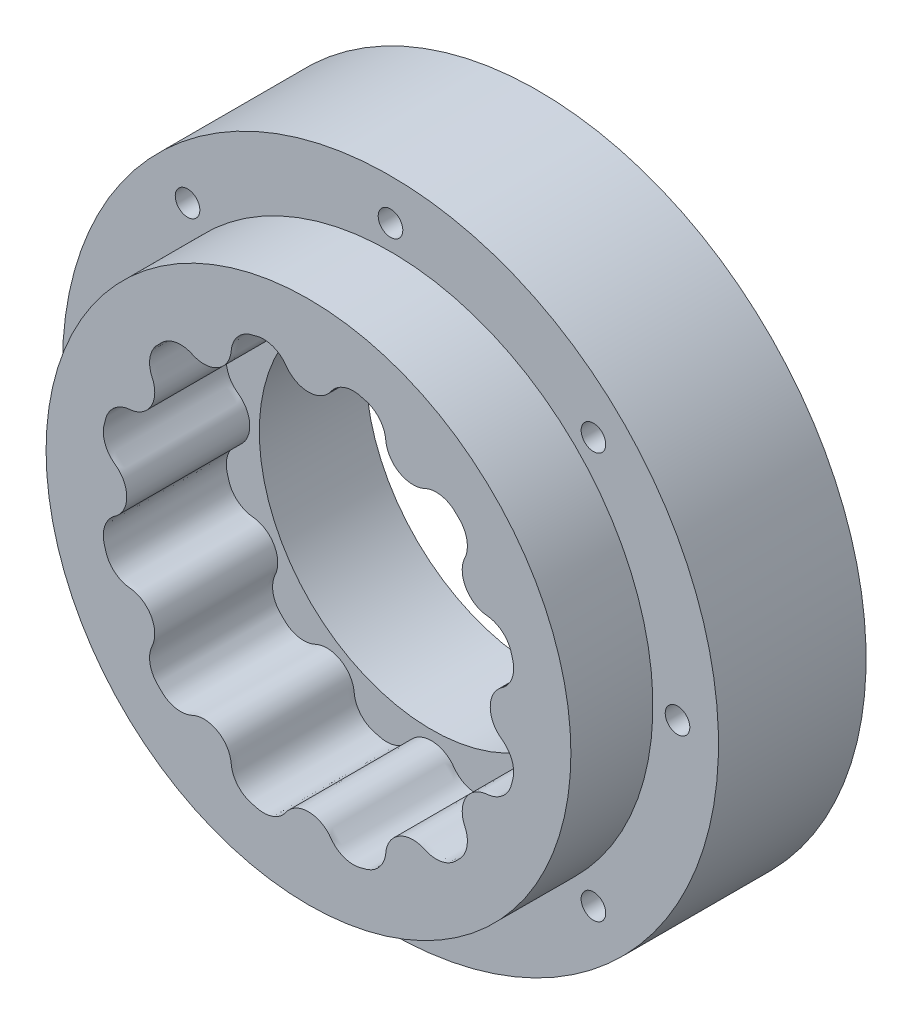
from build123d import *

# Parameters (mm, degrees)
SKETCH1_R           = 32
BOSS_EXTRUDE1_DEPTH = 15
SKETCH3_R           = 40
SKETCH3_R_2         = 30
BOSS_EXTRUDE3_DEPTH = 5
BOSS_EXTRUDE4_START = 13
SKETCH4_R           = 40
SKETCH4_R_2         = 21
BOSS_EXTRUDE4_DEPTH = 13
SKETCH5_R           = 1.5
CUT_EXTRUDE1_DEPTH  = 20
SKETCH6_R           = 2.5
CUT_EXTRUDE2_DEPTH  = 3


with BuildPart() as part:
    # Sketch1 → Boss-Extrude1 (new body)
    with BuildSketch(Plane.XY):
        Circle(SKETCH1_R)
        with BuildLine():
            add(Edge.make_bspline(
                [(7.008727405, -24.725851657), (8.387650315, -24.334985655), (9.300444766, -23.229992029), (9.423952389, -21.802073792), (9.424010864, -21.801397737), (9.424127402, -21.800045592), (9.424300875, -21.79801726), (9.42441742, -21.796665116), (9.424475899, -21.795989061), (9.64427829, -19.254928914), (11.853118443, -17.979654457), (14.163642278, -19.059830077), (14.164256998, -19.06011746), (14.165486262, -19.060692601), (14.167329586, -19.061556535), (14.168558847, -19.062131682), (14.169173565, -19.062419069), (15.452230516, -19.662259733), (16.850366203, -19.435851779), (17.878544188, -18.46173988), (17.885306871, -18.455332808), (17.898778593, -18.442462044), (17.918818206, -18.422980608), (17.93216718, -18.409982809), (17.938838132, -18.403480282), (18.095694749, -18.250583904), (18.250583904, -18.095694749), (18.403480282, -17.938838132), (18.409982809, -17.93216718), (18.422980608, -17.918818206), (18.442462044, -17.898778593), (18.455332808, -17.885306871), (18.46173988, -17.878544188), (19.435851779, -16.850366203), (19.662259733, -15.452230516), (19.062419069, -14.169173565), (19.062131682, -14.168558847), (19.061556535, -14.167329586), (19.060692601, -14.165486262), (19.06011746, -14.164256998), (19.059830077, -14.163642278), (17.979654457, -11.853118443), (19.254928914, -9.64427829), (21.795989061, -9.424475899), (21.796665116, -9.42441742), (21.79801726, -9.424300875), (21.800045592, -9.424127402), (21.801397737, -9.424010864), (21.802073792, -9.423952389), (23.213154038, -9.301901166), (24.310771085, -8.406758284), (24.71414339, -7.04906364), (24.716796509, -7.040133612), (24.72202798, -7.022251341), (24.729642076, -6.995360117), (24.734703727, -6.977429206), (24.737229677, -6.968462376), (24.796623304, -6.75762192), (24.85331667, -6.5460394), (24.907300508, -6.333749395), (24.909596386, -6.324720918), (24.914178322, -6.306661468), (24.921029935, -6.279565937), (24.925440483, -6.261463701), (24.927607828, -6.25240351), (25.257124487, -4.874919305), (24.754131682, -3.550894306), (23.593125953, -2.739654723), (23.59256971, -2.739266055), (23.591456988, -2.738489058), (23.589787137, -2.73732466), (23.588674418, -2.736547656), (23.588118177, -2.736158985), (21.497396733, -1.275274457), (21.497396733, 1.275274457), (23.588118177, 2.736158985), (23.588674418, 2.736547656), (23.589787137, 2.73732466), (23.591456988, 2.738489058), (23.59256971, 2.739266055), (23.593125953, 2.739654723), (24.754131682, 3.550894306), (25.257124487, 4.874919305), (24.927607828, 6.25240351), (24.925440483, 6.261463701), (24.921029935, 6.279565937), (24.914178322, 6.306661468), (24.909596386, 6.324720918), (24.907300508, 6.333749395), (24.85331667, 6.5460394), (24.796623304, 6.75762192), (24.737229677, 6.968462376), (24.734703727, 6.977429206), (24.729642076, 6.995360117), (24.72202798, 7.022251341), (24.716796509, 7.040133612), (24.71414339, 7.04906364), (24.310771085, 8.406758284), (23.213154038, 9.301901166), (21.802073792, 9.423952389), (21.801397737, 9.424010864), (21.800045592, 9.424127402), (21.79801726, 9.424300875), (21.796665116, 9.42441742), (21.795989061, 9.424475899), (19.254928914, 9.64427829), (17.979654457, 11.853118443), (19.059830077, 14.163642278), (19.06011746, 14.164256998), (19.060692601, 14.165486262), (19.061556535, 14.167329586), (19.062131682, 14.168558847), (19.062419069, 14.169173565), (19.662259733, 15.452230516), (19.435851779, 16.850366203), (18.46173988, 17.878544188), (18.455332808, 17.885306871), (18.442462044, 17.898778593), (18.422980608, 17.918818206), (18.409982809, 17.93216718), (18.403480282, 17.938838132), (18.250583904, 18.095694749), (18.095694749, 18.250583904), (17.938838132, 18.403480282), (17.93216718, 18.409982809), (17.918818206, 18.422980608), (17.898778593, 18.442462044), (17.885306871, 18.455332808), (17.878544188, 18.46173988), (16.850366203, 19.435851779), (15.452230516, 19.662259733), (14.169173565, 19.062419069), (14.168558847, 19.062131682), (14.167329586, 19.061556535), (14.165486262, 19.060692601), (14.164256998, 19.06011746), (14.163642278, 19.059830077), (11.853118443, 17.979654457), (9.64427829, 19.254928914), (9.424475899, 21.795989061), (9.42441742, 21.796665116), (9.424300875, 21.79801726), (9.424127402, 21.800045592), (9.424010864, 21.801397737), (9.423952389, 21.802073792), (9.301901166, 23.213154038), (8.406758284, 24.310771085), (7.04906364, 24.71414339), (7.040133612, 24.716796509), (7.022251341, 24.72202798), (6.995360117, 24.729642076), (6.977429206, 24.734703727), (6.968462376, 24.737229677), (6.75762192, 24.796623304), (6.5460394, 24.85331667), (6.333749395, 24.907300508), (6.324720918, 24.909596386), (6.306661468, 24.914178322), (6.279565937, 24.921029935), (6.261463701, 24.925440483), (6.25240351, 24.927607828), (4.874919305, 25.257124487), (3.550894306, 24.754131682), (2.739654723, 23.593125953), (2.739266055, 23.59256971), (2.738489058, 23.591456988), (2.73732466, 23.589787137), (2.736547656, 23.588674418), (2.736158985, 23.588118177), (1.275274457, 21.497396733), (-1.275274457, 21.497396733), (-2.736158985, 23.588118177), (-2.736547656, 23.588674418), (-2.73732466, 23.589787137), (-2.738489058, 23.591456988), (-2.739266055, 23.59256971), (-2.739654723, 23.593125953), (-3.550894306, 24.754131682), (-4.874919305, 25.257124487), (-6.25240351, 24.927607828), (-6.261463701, 24.925440483), (-6.279565937, 24.921029935), (-6.306661468, 24.914178322), (-6.324720918, 24.909596386), (-6.333749395, 24.907300508), (-6.5460394, 24.85331667), (-6.75762192, 24.796623304), (-6.968462376, 24.737229677), (-6.977429206, 24.734703727), (-6.995360117, 24.729642076), (-7.022251341, 24.72202798), (-7.040133612, 24.716796509), (-7.04906364, 24.71414339), (-8.406758284, 24.310771085), (-9.301901166, 23.213154038), (-9.423952389, 21.802073792), (-9.424010864, 21.801397737), (-9.424127402, 21.800045592), (-9.424300875, 21.79801726), (-9.42441742, 21.796665116), (-9.424475899, 21.795989061), (-9.64427829, 19.254928914), (-11.853118443, 17.979654457), (-14.163642278, 19.059830077), (-14.164256998, 19.06011746), (-14.165486262, 19.060692601), (-14.167329586, 19.061556535), (-14.168558847, 19.062131682), (-14.169173565, 19.062419069), (-15.452230516, 19.662259733), (-16.850366203, 19.435851779), (-17.878544188, 18.46173988), (-17.885306871, 18.455332808), (-17.898778593, 18.442462044), (-17.918818206, 18.422980608), (-17.93216718, 18.409982809), (-17.938838132, 18.403480282), (-18.095694749, 18.250583904), (-18.250583904, 18.095694749), (-18.403480282, 17.938838132), (-18.409982809, 17.93216718), (-18.422980608, 17.918818206), (-18.442462044, 17.898778593), (-18.455332808, 17.885306871), (-18.46173988, 17.878544188), (-19.435851779, 16.850366203), (-19.662259733, 15.452230516), (-19.062419069, 14.169173565), (-19.062131682, 14.168558847), (-19.061556535, 14.167329586), (-19.060692601, 14.165486262), (-19.06011746, 14.164256998), (-19.059830077, 14.163642278), (-17.979654457, 11.853118443), (-19.254928914, 9.64427829), (-21.795989061, 9.424475899), (-21.796665116, 9.42441742), (-21.79801726, 9.424300875), (-21.800045592, 9.424127402), (-21.801397737, 9.424010864), (-21.802073792, 9.423952389), (-23.213154038, 9.301901166), (-24.310771085, 8.406758284), (-24.71414339, 7.04906364), (-24.716796509, 7.040133612), (-24.72202798, 7.022251341), (-24.729642076, 6.995360117), (-24.734703727, 6.977429206), (-24.737229677, 6.968462376), (-24.796623304, 6.75762192), (-24.85331667, 6.5460394), (-24.907300508, 6.333749395), (-24.909596386, 6.324720918), (-24.914178322, 6.306661468), (-24.921029935, 6.279565937), (-24.925440483, 6.261463701), (-24.927607828, 6.25240351), (-25.257124487, 4.874919305), (-24.754131682, 3.550894306), (-23.593125953, 2.739654723), (-23.59256971, 2.739266055), (-23.591456988, 2.738489058), (-23.589787137, 2.73732466), (-23.588674418, 2.736547656), (-23.588118177, 2.736158985), (-21.497396733, 1.275274457), (-21.497396733, -1.275274457), (-23.588118177, -2.736158985), (-23.588674418, -2.736547656), (-23.589787137, -2.73732466), (-23.591456988, -2.738489058), (-23.59256971, -2.739266055), (-23.593125953, -2.739654723), (-24.754131682, -3.550894306), (-25.257124487, -4.874919305), (-24.927607828, -6.25240351), (-24.925440483, -6.261463701), (-24.921029935, -6.279565937), (-24.914178322, -6.306661468), (-24.909596386, -6.324720918), (-24.907300508, -6.333749395), (-24.85331667, -6.5460394), (-24.796623304, -6.75762192), (-24.737229677, -6.968462376), (-24.734703727, -6.977429206), (-24.729642076, -6.995360117), (-24.72202798, -7.022251341), (-24.716796509, -7.040133612), (-24.71414339, -7.04906364), (-24.310771085, -8.406758284), (-23.213154038, -9.301901166), (-21.802073792, -9.423952389), (-21.801397737, -9.424010864), (-21.800045592, -9.424127402), (-21.79801726, -9.424300875), (-21.796665116, -9.42441742), (-21.795989061, -9.424475899), (-19.254928914, -9.64427829), (-17.979654457, -11.853118443), (-19.059830077, -14.163642278), (-19.06011746, -14.164256998), (-19.060692601, -14.165486262), (-19.061556535, -14.167329586), (-19.062131682, -14.168558847), (-19.062419069, -14.169173565), (-19.662259733, -15.452230516), (-19.435851779, -16.850366203), (-18.46173988, -17.878544188), (-18.455332808, -17.885306871), (-18.442462044, -17.898778593), (-18.422980608, -17.918818206), (-18.409982809, -17.93216718), (-18.403480282, -17.938838132), (-18.250583904, -18.095694749), (-18.095694749, -18.250583904), (-17.938838132, -18.403480282), (-17.93216718, -18.409982809), (-17.918818206, -18.422980608), (-17.898778593, -18.442462044), (-17.885306871, -18.455332808), (-17.878544188, -18.46173988), (-16.850366203, -19.435851779), (-15.452230516, -19.662259733), (-14.169173565, -19.062419069), (-14.168558847, -19.062131682), (-14.167329586, -19.061556535), (-14.165486262, -19.060692601), (-14.164256998, -19.06011746), (-14.163642278, -19.059830077), (-11.853118443, -17.979654457), (-9.64427829, -19.254928914), (-9.424475899, -21.795989061), (-9.42441742, -21.796665116), (-9.424300875, -21.79801726), (-9.424127402, -21.800045592), (-9.424010864, -21.801397737), (-9.423952389, -21.802073792), (-9.301901166, -23.213154038), (-8.406758284, -24.310771085), (-7.04906364, -24.71414339), (-7.040133612, -24.716796509), (-7.022251341, -24.72202798), (-6.995360117, -24.729642076), (-6.977429206, -24.734703727), (-6.968462376, -24.737229677), (-6.75762192, -24.796623304), (-6.5460394, -24.85331667), (-6.333749395, -24.907300508), (-6.324720918, -24.909596386), (-6.306661468, -24.914178322), (-6.279565937, -24.921029935), (-6.261463701, -24.925440483), (-6.25240351, -24.927607828), (-4.874919305, -25.257124487), (-3.550894306, -24.754131682), (-2.739654723, -23.593125953), (-2.739266055, -23.59256971), (-2.738489058, -23.591456988), (-2.73732466, -23.589787137), (-2.736547656, -23.588674418), (-2.736158985, -23.588118177), (-1.275274457, -21.497396733), (1.275274457, -21.497396733), (2.736158985, -23.588118177), (2.736547656, -23.588674418), (2.73732466, -23.589787137), (2.738489058, -23.591456988), (2.739266055, -23.59256971), (2.739654723, -23.593125953), (3.56057458, -24.76798561), (4.903574577, -25.268540935), (6.293189848, -24.917579368), (6.372992785, -24.897424319), (6.531107676, -24.851210749), (6.769500213, -24.787333662), (6.92953851, -24.748298341), (7.008727405, -24.725851657)],
                knots=[0, 0, 0, 0, 0.022861669, 0.022861669, 0.022861669, 0.022873941, 0.022886214, 0.022898486, 0.022898486, 0.022898486, 0.055887763, 0.055887763, 0.055887763, 0.055900036, 0.055912308, 0.05592458, 0.05592458, 0.05592458, 0.078577418, 0.078577418, 0.078577418, 0.078745896, 0.078914374, 0.079082852, 0.079082852, 0.079082852, 0.083044128, 0.083044128, 0.083044128, 0.083212606, 0.083381085, 0.083549563, 0.083549563, 0.083549563, 0.1062024, 0.1062024, 0.1062024, 0.106214673, 0.106226945, 0.106239217, 0.106239217, 0.106239217, 0.139228495, 0.139228495, 0.139228495, 0.139240767, 0.139253039, 0.139265311, 0.139265311, 0.139265311, 0.161918149, 0.161918149, 0.161918149, 0.162086627, 0.162255106, 0.162423584, 0.162423584, 0.162423584, 0.16638486, 0.16638486, 0.16638486, 0.166553338, 0.166721816, 0.166890294, 0.166890294, 0.166890294, 0.189543132, 0.189543132, 0.189543132, 0.189555404, 0.189567676, 0.189579948, 0.189579948, 0.189579948, 0.222569226, 0.222569226, 0.222569226, 0.222581498, 0.222593771, 0.222606043, 0.222606043, 0.222606043, 0.24525888, 0.24525888, 0.24525888, 0.245427359, 0.245595837, 0.245764315, 0.245764315, 0.245764315, 0.249725591, 0.249725591, 0.249725591, 0.249894069, 0.250062547, 0.250231025, 0.250231025, 0.250231025, 0.272883863, 0.272883863, 0.272883863, 0.272896135, 0.272908408, 0.27292068, 0.27292068, 0.27292068, 0.305909957, 0.305909957, 0.305909957, 0.30592223, 0.305934502, 0.305946774, 0.305946774, 0.305946774, 0.328599612, 0.328599612, 0.328599612, 0.32876809, 0.328936568, 0.329105046, 0.329105046, 0.329105046, 0.333066322, 0.333066322, 0.333066322, 0.3332348, 0.333403279, 0.333571757, 0.333571757, 0.333571757, 0.356224594, 0.356224594, 0.356224594, 0.356236867, 0.356249139, 0.356261411, 0.356261411, 0.356261411, 0.389250689, 0.389250689, 0.389250689, 0.389262961, 0.389275233, 0.389287505, 0.389287505, 0.389287505, 0.411940343, 0.411940343, 0.411940343, 0.412108821, 0.4122773, 0.412445778, 0.412445778, 0.412445778, 0.416407054, 0.416407054, 0.416407054, 0.416575532, 0.41674401, 0.416912488, 0.416912488, 0.416912488, 0.439565326, 0.439565326, 0.439565326, 0.439577598, 0.43958987, 0.439602142, 0.439602142, 0.439602142, 0.47259142, 0.47259142, 0.47259142, 0.472603692, 0.472615965, 0.472628237, 0.472628237, 0.472628237, 0.495281074, 0.495281074, 0.495281074, 0.495449553, 0.495618031, 0.495786509, 0.495786509, 0.495786509, 0.499747785, 0.499747785, 0.499747785, 0.499916263, 0.500084741, 0.500253219, 0.500253219, 0.500253219, 0.522906057, 0.522906057, 0.522906057, 0.522918329, 0.522930602, 0.522942874, 0.522942874, 0.522942874, 0.555932151, 0.555932151, 0.555932151, 0.555944424, 0.555956696, 0.555968968, 0.555968968, 0.555968968, 0.578621806, 0.578621806, 0.578621806, 0.578790284, 0.578958762, 0.57912724, 0.57912724, 0.57912724, 0.583088516, 0.583088516, 0.583088516, 0.583256994, 0.583425473, 0.583593951, 0.583593951, 0.583593951, 0.606246788, 0.606246788, 0.606246788, 0.606259061, 0.606271333, 0.606283605, 0.606283605, 0.606283605, 0.639272883, 0.639272883, 0.639272883, 0.639285155, 0.639297427, 0.639309699, 0.639309699, 0.639309699, 0.661962537, 0.661962537, 0.661962537, 0.662131015, 0.662299493, 0.662467972, 0.662467972, 0.662467972, 0.666429248, 0.666429248, 0.666429248, 0.666597726, 0.666766204, 0.666934682, 0.666934682, 0.666934682, 0.68958752, 0.68958752, 0.68958752, 0.689599792, 0.689612064, 0.689624336, 0.689624336, 0.689624336, 0.722613614, 0.722613614, 0.722613614, 0.722625886, 0.722638159, 0.722650431, 0.722650431, 0.722650431, 0.745303268, 0.745303268, 0.745303268, 0.745471747, 0.745640225, 0.745808703, 0.745808703, 0.745808703, 0.749769979, 0.749769979, 0.749769979, 0.749938457, 0.750106935, 0.750275413, 0.750275413, 0.750275413, 0.772928251, 0.772928251, 0.772928251, 0.772940523, 0.772952796, 0.772965068, 0.772965068, 0.772965068, 0.805954345, 0.805954345, 0.805954345, 0.805966618, 0.80597889, 0.805991162, 0.805991162, 0.805991162, 0.828644, 0.828644, 0.828644, 0.828812478, 0.828980956, 0.829149434, 0.829149434, 0.829149434, 0.83311071, 0.83311071, 0.83311071, 0.833279188, 0.833447667, 0.833616145, 0.833616145, 0.833616145, 0.856268982, 0.856268982, 0.856268982, 0.856281255, 0.856293527, 0.856305799, 0.856305799, 0.856305799, 0.889295077, 0.889295077, 0.889295077, 0.889307349, 0.889319621, 0.889331893, 0.889331893, 0.889331893, 0.911984731, 0.911984731, 0.911984731, 0.912153209, 0.912321687, 0.912490166, 0.912490166, 0.912490166, 0.916451442, 0.916451442, 0.916451442, 0.91661992, 0.916788398, 0.916956876, 0.916956876, 0.916956876, 0.939609714, 0.939609714, 0.939609714, 0.939621986, 0.939634258, 0.93964653, 0.93964653, 0.93964653, 0.972635808, 0.972635808, 0.972635808, 0.97264808, 0.972660353, 0.972672625, 0.972672625, 0.972672625, 0.995534294, 0.995534294, 0.995534294, 0.997022863, 0.998511431, 1, 1, 1, 1], degree=3, weights=[1, 0.881989361, 0.881989361, 1, 1, 1, 1, 1, 1, 0.715181732, 0.715181732, 1, 1, 1, 1, 1, 1, 0.884361143, 0.884361143, 1, 1, 1, 1, 1, 1, 0.99994552, 0.99994552, 1, 1, 1, 1, 1, 1, 0.884361143, 0.884361143, 1, 1, 1, 1, 1, 1, 0.715181732, 0.715181732, 1, 1, 1, 1, 1, 1, 0.884361143, 0.884361143, 1, 1, 1, 1, 1, 1, 0.99994552, 0.99994552, 1, 1, 1, 1, 1, 1, 0.884361143, 0.884361143, 1, 1, 1, 1, 1, 1, 0.715181732, 0.715181732, 1, 1, 1, 1, 1, 1, 0.884361143, 0.884361143, 1, 1, 1, 1, 1, 1, 0.99994552, 0.99994552, 1, 1, 1, 1, 1, 1, 0.884361143, 0.884361143, 1, 1, 1, 1, 1, 1, 0.715181732, 0.715181732, 1, 1, 1, 1, 1, 1, 0.884361143, 0.884361143, 1, 1, 1, 1, 1, 1, 0.99994552, 0.99994552, 1, 1, 1, 1, 1, 1, 0.884361143, 0.884361143, 1, 1, 1, 1, 1, 1, 0.715181732, 0.715181732, 1, 1, 1, 1, 1, 1, 0.884361143, 0.884361143, 1, 1, 1, 1, 1, 1, 0.99994552, 0.99994552, 1, 1, 1, 1, 1, 1, 0.884361143, 0.884361143, 1, 1, 1, 1, 1, 1, 0.715181732, 0.715181732, 1, 1, 1, 1, 1, 1, 0.884361143, 0.884361143, 1, 1, 1, 1, 1, 1, 0.99994552, 0.99994552, 1, 1, 1, 1, 1, 1, 0.884361143, 0.884361143, 1, 1, 1, 1, 1, 1, 0.715181732, 0.715181732, 1, 1, 1, 1, 1, 1, 0.884361143, 0.884361143, 1, 1, 1, 1, 1, 1, 0.99994552, 0.99994552, 1, 1, 1, 1, 1, 1, 0.884361143, 0.884361143, 1, 1, 1, 1, 1, 1, 0.715181732, 0.715181732, 1, 1, 1, 1, 1, 1, 0.884361143, 0.884361143, 1, 1, 1, 1, 1, 1, 0.99994552, 0.99994552, 1, 1, 1, 1, 1, 1, 0.884361143, 0.884361143, 1, 1, 1, 1, 1, 1, 0.715181732, 0.715181732, 1, 1, 1, 1, 1, 1, 0.884361143, 0.884361143, 1, 1, 1, 1, 1, 1, 0.99994552, 0.99994552, 1, 1, 1, 1, 1, 1, 0.884361143, 0.884361143, 1, 1, 1, 1, 1, 1, 0.715181732, 0.715181732, 1, 1, 1, 1, 1, 1, 0.884361143, 0.884361143, 1, 1, 1, 1, 1, 1, 0.99994552, 0.99994552, 1, 1, 1, 1, 1, 1, 0.884361143, 0.884361143, 1, 1, 1, 1, 1, 1, 0.715181732, 0.715181732, 1, 1, 1, 1, 1, 1, 0.884361143, 0.884361143, 1, 1, 1, 1, 1, 1, 0.99994552, 0.99994552, 1, 1, 1, 1, 1, 1, 0.884361143, 0.884361143, 1, 1, 1, 1, 1, 1, 0.715181732, 0.715181732, 1, 1, 1, 1, 1, 1, 0.881989361, 0.881989361, 1, 1, 1, 1, 1, 1]))
        make_face(mode=Mode.SUBTRACT)
    extrude(amount=BOSS_EXTRUDE1_DEPTH)

    # Sketch3 → Boss-Extrude3 (add)
    with BuildSketch(Plane(origin=(0, 0, 0), x_dir=(-1, 0, 0), z_dir=(0, 0, -1))):
        Circle(SKETCH3_R)
        Circle(SKETCH3_R_2, mode=Mode.SUBTRACT)
    extrude(amount=-BOSS_EXTRUDE3_DEPTH)

    # Sketch4 → Boss-Extrude4 (add)
    with BuildSketch(Plane(origin=(0, 0, 0), x_dir=(-1, 0, 0), z_dir=(0, 0, -1)).offset(BOSS_EXTRUDE4_START)):
        Circle(SKETCH4_R)
        with Locations(Location((0, 0, 0), (0, 0, 180))):
            Circle(SKETCH4_R_2, mode=Mode.SUBTRACT)
    extrude(amount=-BOSS_EXTRUDE4_DEPTH)

    # Sketch5 → Cut-Extrude1 (cut)
    with BuildSketch(Plane(origin=(0, 0, -13), x_dir=(-1, 0, 0), z_dir=(0, 0, -1))):
        with Locations((0, 35)):
            Circle(SKETCH5_R)
        with Locations((24.748737342, 24.748737342)):
            Circle(SKETCH5_R)
        with Locations((35, 0)):
            Circle(SKETCH5_R)
        with Locations((24.748737342, -24.748737342)):
            Circle(SKETCH5_R)
        with Locations((0, -35)):
            Circle(SKETCH5_R)
        with Locations((-24.748737342, -24.748737342)):
            Circle(SKETCH5_R)
        with Locations((-35, 0)):
            Circle(SKETCH5_R)
        with Locations((-24.748737342, 24.748737342)):
            Circle(SKETCH5_R)
    extrude(amount=-CUT_EXTRUDE1_DEPTH, mode=Mode.SUBTRACT)

    # Sketch6 → Cut-Extrude2 (cut)
    with BuildSketch(Plane(origin=(0, 0, -13), x_dir=(-1, 0, 0), z_dir=(0, 0, -1))):
        with Locations((0, 35)):
            Circle(SKETCH6_R)
        with Locations((35, 0)):
            Circle(SKETCH6_R)
        with Locations((0, -35)):
            Circle(SKETCH6_R)
        with Locations((-35, 0)):
            Circle(SKETCH6_R)
    extrude(amount=-CUT_EXTRUDE2_DEPTH, mode=Mode.SUBTRACT)


solid = part.part
